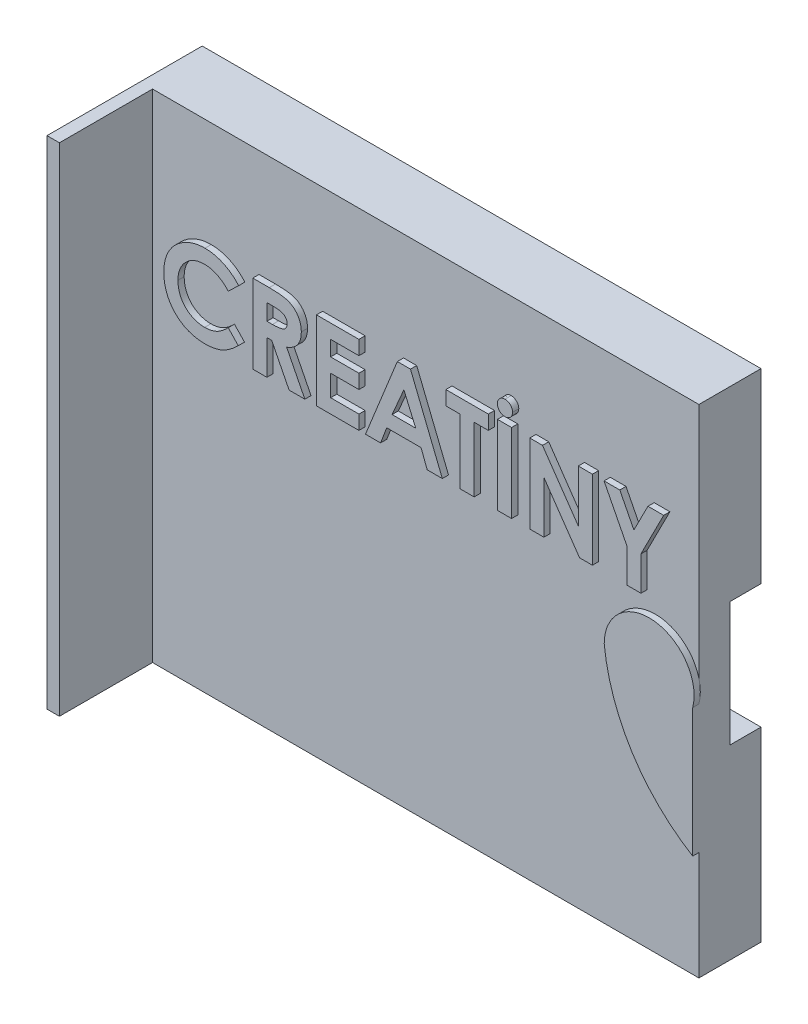
from build123d import *

# Parameters (mm, degrees)
IZIM1_W                     = 90
IZIM1_H                     = 80
Y_KSEKLIK_EKSTR_ZYON1_DEPTH = 5
IZIM2_W                     = 5
IZIM2_H                     = 20
KES_EKSTR_ZYON1_DEPTH       = 50
IZIM3_W                     = 15
IZIM3_H                     = 80
Y_KSEKLIK_EKSTR_ZYON2_DEPTH = 2
IZIM4_W                     = 2.279487179
IZIM4_H                     = 12.7
Y_KSEKLIK_EKSTR_ZYON3_DEPTH = 1


with BuildPart() as part:
    # Çizim1 → Yükseklik-Ekstrüzyon1 (new, symmetric)
    with BuildSketch(Plane.XY):
        Rectangle(IZIM1_W, IZIM1_H)
    extrude(amount=Y_KSEKLIK_EKSTR_ZYON1_DEPTH, both=True)

    # Çizim2 → Kes-Ekstrüzyon1 (cut)
    with BuildSketch(Plane(origin=(45, 0, 0), x_dir=(0, 0, -1), z_dir=(1, 0, 0))):
        with Locations((2.5, 0)):
            Rectangle(IZIM2_W, IZIM2_H)
    extrude(amount=-KES_EKSTR_ZYON1_DEPTH, mode=Mode.SUBTRACT)

    # Çizim3 → Yükseklik-Ekstrüzyon2 (add)
    with BuildSketch(Plane(origin=(-45, 0, 0), x_dir=(0, 0, -1), z_dir=(1, 0, 0))):
        with Locations((-12.5, 0)):
            Rectangle(IZIM3_W, IZIM3_H)
    extrude(amount=Y_KSEKLIK_EKSTR_ZYON2_DEPTH)

    # Çizim4 → Yükseklik-Ekstrüzyon3 (add)
    # profile 1 of 10: a face of its own
    with BuildSketch(Plane.XY.offset(5)):
        with BuildLine():
            Line((45, -1.789166458), (45, -22.5))
            ThreePointArc((45, -22.5), (35.238280105, -12.918835566), (30.744553942, 0))
            ThreePointArc((30.744553942, 0), (38.886155446, 7.183642163), (45, -1.789166458))
        make_face()
    # profile 2 of 10: a face of its own
    with BuildSketch(Plane.XY.offset(5)):
        with BuildLine():
            Line((-28.137179487, 20.496834936), (-29.808633814, 18.899158654))
            add(Edge.make_bspline(
                [(-29.808633814, 18.899158654), (-29.950420187, 19.045766001), (-30.227373394, 19.332136081), (-30.673649235, 19.71126483), (-31.13775986, 20.027217344), (-31.610676924, 20.29331054), (-32.100906834, 20.494629007), (-32.602781197, 20.641333165), (-33.119504629, 20.730773146), (-33.469203172, 20.741006662), (-33.645092147, 20.746153846)],
                knots=[0, 0, 0, 0, 1.115251505, 2.178435587, 3.19620269, 4.182487026, 5.141301733, 6.088180966, 7.038406374, 8, 8, 8, 8], degree=3))
            add(Edge.make_bspline(
                [(-33.645092147, 20.746153846), (-33.791980816, 20.742087391), (-34.081849421, 20.734062689), (-34.507452492, 20.675233713), (-34.914563825, 20.575192477), (-35.304577027, 20.437317123), (-35.676344466, 20.258913733), (-36.030645601, 20.040120387), (-36.366606915, 19.782913099), (-36.679790555, 19.488622671), (-36.966279943, 19.167088264), (-37.219411558, 18.824011819), (-37.431449891, 18.460179305), (-37.605466301, 18.079275349), (-37.741018358, 17.679536941), (-37.837819558, 17.261233199), (-37.893806784, 16.823865956), (-37.902163253, 16.526546964), (-37.906410256, 16.375440705)],
                knots=[0, 0, 0, 0, 1.035432265, 2.043311493, 3.022114605, 3.98653278, 4.95457646, 5.923598177, 6.917315552, 7.932509744, 8.948865224, 9.949768934, 10.933144597, 11.912367597, 12.897413939, 13.903909035, 14.934704909, 16, 16, 16, 16], degree=3))
            add(Edge.make_bspline(
                [(-37.906410256, 16.375440705), (-37.905186319, 16.26938376), (-37.902773912, 16.060343343), (-37.876365854, 15.751114549), (-37.833842653, 15.451089514), (-37.772301046, 15.160722695), (-37.695342662, 14.879762458), (-37.605052954, 14.605784974), (-37.491785843, 14.342575994), (-37.366057641, 14.087078518), (-37.219837191, 13.846264113), (-37.062184572, 13.616627591), (-36.891236046, 13.39929461), (-36.70588437, 13.195153631), (-36.503520948, 13.007394922), (-36.289376128, 12.830372355), (-36.059837582, 12.668517404), (-35.819673407, 12.517768141), (-35.566808889, 12.386810973), (-35.308104827, 12.26818908), (-35.039638748, 12.171850466), (-34.764679387, 12.094192754), (-34.484209352, 12.028156468), (-34.195485385, 11.987495897), (-33.901010361, 11.956704123), (-33.701994673, 11.954802911), (-33.601842949, 11.953846154)],
                knots=[0, 0, 0, 0, 1.103660481, 2.175337485, 3.227646561, 4.255952547, 5.262355991, 6.258840057, 7.255597736, 8.242457506, 9.22035537, 10.185017736, 11.140346927, 12.096287581, 13.051739095, 14.01125915, 14.986044842, 15.97314143, 16.960198552, 17.947847494, 18.933482797, 19.925264591, 20.920966487, 21.929612487, 22.958107872, 24, 24, 24, 24], degree=3))
            add(Edge.make_bspline(
                [(-33.601842949, 11.953846154), (-33.431968413, 11.958759827), (-33.098209124, 11.968413917), (-32.608369378, 12.043907532), (-32.141600899, 12.168090257), (-31.768655119, 12.314742839), (-31.476461951, 12.459564168), (-31.254019611, 12.593516765), (-31.023996895, 12.743357453), (-30.790214283, 12.91474138), (-30.550042184, 13.105611871), (-30.30772019, 13.320149346), (-30.057044815, 13.551289394), (-29.892829861, 13.716258587), (-29.808633814, 13.800841346)],
                knots=[0, 0, 0, 0, 1.404581149, 2.759636711, 4.088442092, 5.392261763, 6.066678138, 6.783632037, 7.538459478, 8.336747902, 9.180226004, 10.074962426, 11.012997595, 12, 12, 12, 12], degree=3))
            Line((-29.808633814, 13.800841346), (-28.188060897, 12.098858173))
            add(Edge.make_bspline(
                [(-28.188060897, 12.098858173), (-28.301978451, 11.988874352), (-28.524321152, 11.774209454), (-28.859718946, 11.469405329), (-29.194694627, 11.19550494), (-29.521155883, 10.942566902), (-29.844450489, 10.717959914), (-30.164544159, 10.521459659), (-30.477813294, 10.348096362), (-30.790763028, 10.200793709), (-31.105340696, 10.075718457), (-31.429004148, 9.968036875), (-31.762742853, 9.87694213), (-32.108595137, 9.803440635), (-32.463335099, 9.744502359), (-32.830282634, 9.704719363), (-33.207111114, 9.677974578), (-33.46271971, 9.675571338), (-33.591666667, 9.674358974)],
                knots=[0, 0, 0, 0, 1.244526981, 2.429050516, 3.560637417, 4.644440555, 5.67424972, 6.652764056, 7.595344123, 8.486817594, 9.369275933, 10.254498637, 11.166417451, 12.086725134, 13.032340136, 13.991389299, 14.986715468, 16, 16, 16, 16], degree=3))
            add(Edge.make_bspline(
                [(-33.591666667, 9.674358974), (-33.828526253, 9.680396998), (-34.291994624, 9.692211731), (-34.971195438, 9.779750903), (-35.616417979, 9.926508784), (-36.229231953, 10.134064907), (-36.8094425, 10.399208127), (-37.356901183, 10.724261264), (-37.870725621, 11.108360704), (-38.346765124, 11.547004428), (-38.777365511, 12.031449597), (-39.157966386, 12.551610806), (-39.472799445, 13.110044456), (-39.734212117, 13.698500699), (-39.938633389, 14.319664889), (-40.082511309, 14.974208936), (-40.171239773, 15.661500838), (-40.180946793, 16.13093705), (-40.185897436, 16.370352564)],
                knots=[0, 0, 0, 0, 1.078019885, 2.10938526, 3.111377082, 4.085535484, 5.04941344, 6.010039228, 6.978205633, 7.964457913, 8.951525778, 9.924444315, 10.892603023, 11.863865945, 12.85144698, 13.863884204, 14.910567087, 16, 16, 16, 16], degree=3))
            add(Edge.make_bspline(
                [(-40.185897436, 16.370352564), (-40.183805534, 16.526497319), (-40.179659896, 16.835938061), (-40.136088854, 17.291769345), (-40.075348289, 17.73612331), (-39.978988905, 18.164386091), (-39.862837171, 18.582327176), (-39.71838723, 18.985404036), (-39.545869787, 19.374775152), (-39.350845487, 19.751092356), (-39.130216447, 20.111890367), (-38.883749589, 20.454069362), (-38.61778993, 20.780270898), (-38.325946895, 21.086167307), (-38.012461343, 21.37444442), (-37.675917924, 21.643540007), (-37.318340779, 21.897313202), (-36.938762078, 22.129219811), (-36.544556026, 22.338991665), (-36.140694597, 22.5240194), (-35.728170032, 22.678659977), (-35.308726522, 22.806928632), (-34.880591925, 22.902672113), (-34.446822155, 22.975146839), (-34.003726353, 23.015660675), (-33.706225908, 23.022293048), (-33.556049679, 23.025641026)],
                knots=[0, 0, 0, 0, 1.071919942, 2.124283339, 3.142214191, 4.149696895, 5.136002878, 6.119640489, 7.086990633, 8.058538607, 9.028339693, 9.988281803, 10.952401235, 11.916291999, 12.888973767, 13.874849856, 14.873389453, 15.898127285, 16.927174885, 17.938320013, 18.946391617, 19.950418109, 20.947802303, 21.956882652, 22.968648068, 24, 24, 24, 24], degree=3))
            add(Edge.make_bspline(
                [(-33.556049679, 23.025641026), (-33.427933958, 23.023721881), (-33.173034563, 23.019903546), (-32.793446589, 22.988073571), (-32.416894382, 22.938084917), (-32.044726114, 22.862662682), (-31.674279657, 22.773126959), (-31.310423094, 22.655892281), (-30.94741639, 22.525212138), (-30.590952765, 22.369010711), (-30.24053465, 22.198502744), (-29.90437114, 22.005055263), (-29.576818081, 21.80057281), (-29.265133853, 21.572953218), (-28.963479937, 21.330452672), (-28.67343371, 21.071939772), (-28.397540497, 20.793104348), (-28.224405235, 20.596090662), (-28.137179487, 20.496834936)],
                knots=[0, 0, 0, 0, 0.996412454, 1.982464992, 2.961075852, 3.949442424, 4.934965278, 5.923860011, 6.921385422, 7.934793307, 8.949617135, 9.951082467, 10.950285876, 11.951772932, 12.951063433, 13.960125323, 14.972308753, 16, 16, 16, 16], degree=3))
        make_face()
    # profile 3 of 10: a face of its own
    with BuildSketch(Plane.XY.offset(5)):
        with BuildLine():
            Line((-25.857692308, 22.7), (-23.201682692, 22.7))
            add(Edge.make_bspline(
                [(-23.201682692, 22.7), (-23.026121265, 22.699376858), (-22.688467188, 22.69817838), (-22.201588451, 22.679269568), (-21.754323374, 22.652956405), (-21.346009741, 22.612801821), (-20.976822235, 22.559561695), (-20.646390845, 22.496800397), (-20.354725227, 22.425270442), (-20.099365586, 22.336138475), (-19.868916138, 22.235598967), (-19.654105213, 22.120077229), (-19.450193764, 21.990859631), (-19.258544718, 21.84454611), (-19.0774926, 21.68376881), (-18.906695844, 21.508365891), (-18.748567967, 21.31685001), (-18.604088104, 21.110431304), (-18.472406338, 20.893283559), (-18.356027275, 20.665108629), (-18.261387628, 20.425747835), (-18.177763354, 20.178660456), (-18.117531499, 19.920314331), (-18.075641125, 19.653224502), (-18.044970632, 19.376450785), (-18.043207225, 19.188423011), (-18.042307692, 19.092508013)],
                knots=[0, 0, 0, 0, 1.749336639, 3.364467119, 4.854658419, 6.213483162, 7.451590619, 8.570285859, 9.5643256, 10.440900261, 11.26203566, 12.067320669, 12.869050712, 13.665104639, 14.467235401, 15.27997916, 16.102287765, 16.939272006, 17.78853747, 18.631303466, 19.488103222, 20.351255419, 21.228522269, 22.127379805, 23.044756219, 24, 24, 24, 24], degree=3))
            add(Edge.make_bspline(
                [(-18.042307692, 19.092508013), (-18.044644355, 18.992394789), (-18.049226125, 18.796091003), (-18.07390603, 18.507736752), (-18.119013143, 18.231859574), (-18.187334428, 17.969267204), (-18.26586087, 17.716691374), (-18.370280896, 17.478792264), (-18.488129216, 17.252109978), (-18.628094222, 17.039851023), (-18.781698979, 16.837300702), (-18.960338079, 16.652219471), (-19.152438454, 16.474659913), (-19.368798765, 16.315743758), (-19.599881649, 16.164725668), (-19.850278479, 16.027863061), (-20.11835508, 15.901715526), (-20.306826206, 15.831366946), (-20.403205128, 15.795392628)],
                knots=[0, 0, 0, 0, 1.099860209, 2.156625411, 3.176576793, 4.16617041, 5.135385252, 6.078461593, 7.016046972, 7.938469504, 8.868247731, 9.803980173, 10.76021508, 11.73834243, 12.748633912, 13.790971185, 14.870363756, 16, 16, 16, 16], degree=3))
            Line((-20.403205128, 15.795392628), (-17.472435897, 10))
            Line((-17.472435897, 10), (-20.006330128, 10))
            Line((-20.006330128, 10), (-22.804807692, 15.535897436))
            Line((-22.804807692, 15.535897436), (-23.578205128, 15.535897436))
            Line((-23.578205128, 15.535897436), (-23.578205128, 10))
            Line((-23.578205128, 10), (-25.857692308, 10))
            Line((-25.857692308, 10), (-25.857692308, 22.7))
        make_face()
        with BuildLine():
            Line((-23.578205128, 17.815384615), (-22.690324519, 17.815384615))
            add(Edge.make_bspline(
                [(-22.690324519, 17.815384615), (-22.581773734, 17.816607187), (-22.373922306, 17.81894815), (-22.075004652, 17.829806504), (-21.803516134, 17.855969773), (-21.55829089, 17.889026085), (-21.338094966, 17.92719437), (-21.144892435, 17.981891842), (-20.975706338, 18.040501566), (-20.832541539, 18.113338251), (-20.710224824, 18.196169359), (-20.60461217, 18.290267557), (-20.517255361, 18.399174239), (-20.445356252, 18.519929791), (-20.389426563, 18.653602268), (-20.348602174, 18.798724247), (-20.325787377, 18.956948855), (-20.323162457, 19.066145378), (-20.321794872, 19.123036859)],
                knots=[0, 0, 0, 0, 1.688639943, 3.233382647, 4.650958383, 5.928841754, 7.082724185, 8.122798841, 9.049171256, 9.863274652, 10.613301712, 11.341792392, 12.054588806, 12.776240173, 13.521029143, 14.301969904, 15.115324896, 16, 16, 16, 16], degree=3))
            add(Edge.make_bspline(
                [(-20.321794872, 19.123036859), (-20.324380418, 19.190343634), (-20.329459243, 19.32255532), (-20.37985697, 19.512893789), (-20.460079266, 19.689065065), (-20.570042061, 19.850273162), (-20.708525905, 19.991599308), (-20.867447042, 20.116179432), (-21.050235374, 20.214688072), (-21.219483615, 20.279663322), (-21.373459953, 20.318538684), (-21.512418741, 20.34750826), (-21.673333853, 20.368039831), (-21.856326773, 20.389817216), (-22.060931045, 20.403938747), (-22.288261885, 20.414244651), (-22.537666399, 20.418461302), (-22.711525033, 20.419809291), (-22.802263622, 20.420512821)],
                knots=[0, 0, 0, 0, 1.020303359, 2.004196876, 2.966617323, 3.9489082, 4.950758222, 5.960522915, 7.003732012, 8.091992268, 8.70421221, 9.413913587, 10.24622431, 11.166358409, 12.212345909, 13.359657661, 14.621978493, 16, 16, 16, 16], degree=3))
            Line((-22.802263622, 20.420512821), (-23.578205128, 20.420512821))
            Line((-23.578205128, 20.420512821), (-23.578205128, 17.815384615))
        make_face(mode=Mode.SUBTRACT)
    # profile 4 of 10: a face of its own
    with BuildSketch(Plane.XY.offset(5)):
        Polygon((-15.6, 22.7), (-8.761538462, 22.7), (-8.761538462, 20.420512821), (-13.320512821, 20.420512821), (-13.320512821, 17.978205128), (-8.761538462, 17.978205128), (-8.761538462, 15.698717949), (-13.320512821, 15.698717949), (-13.320512821, 12.279487179), (-8.761538462, 12.279487179), (-8.761538462, 10), (-15.6, 10), align=None)
    # profile 5 of 10: a face of its own
    with BuildSketch(Plane.XY.offset(5)):
        Polygon((-2.571814904, 22.7), (-0.457692308, 22.7), (4.671153846, 10), (2.236478365, 10), (1.249379006, 12.605128205), (-4.283974359, 12.605128205), (-5.271073718, 10), (-7.703205128, 10), align=None)
        Polygon((-1.516025641, 19.293489583), (-3.418990385, 14.884615385), (0.386939103, 14.884615385), align=None, mode=Mode.SUBTRACT)
    # profile 6 of 10: a face of its own
    with BuildSketch(Plane.XY.offset(5)):
        Polygon((5.241025641, 22.7), (12.079487179, 22.7), (12.079487179, 20.420512821), (9.8, 20.420512821), (9.8, 10), (7.520512821, 10), (7.520512821, 20.420512821), (5.241025641, 20.420512821), align=None)
    # profile 7 of 10: a face of its own
    with BuildSketch(Plane.XY.offset(5)):
        with Locations((14.684615385, 16.35)):
            Rectangle(IZIM4_W, IZIM4_H)
    # profile 8 of 10: a face of its own
    with BuildSketch(Plane.XY.offset(5)):
        with BuildLine():
            add(Edge.make_bspline(
                [(14.7609375, 26.119230769), (14.843654107, 26.114880169), (15.005099411, 26.10638872), (15.237036846, 26.038094928), (15.4479974, 25.922946037), (15.633157807, 25.76517222), (15.790104297, 25.580456585), (15.906107539, 25.371804854), (15.974067151, 25.143085752), (15.98275203, 24.984175696), (15.987179487, 24.903165064)],
                knots=[0, 0, 0, 0, 1.033757622, 2.017676021, 2.99585523, 4.020311853, 5.044768476, 6.013636162, 6.987373143, 8, 8, 8, 8], degree=3))
            add(Edge.make_bspline(
                [(15.987179487, 24.903165064), (15.982864816, 24.820430855), (15.97444349, 24.658951194), (15.905429712, 24.426539295), (15.791633707, 24.214066542), (15.633807903, 24.028376665), (15.447148539, 23.873419286), (15.237134274, 23.757934293), (15.005073547, 23.68979821), (14.843645344, 23.681284885), (14.7609375, 23.676923077)],
                knots=[0, 0, 0, 0, 1.028208009, 2.006844351, 2.989059939, 4.008016881, 5.020227687, 5.993155649, 6.971791991, 8, 8, 8, 8], degree=3))
            add(Edge.make_bspline(
                [(14.7609375, 23.676923077), (14.679918664, 23.681326402), (14.520992516, 23.689963942), (14.291670069, 23.758482795), (14.082491084, 23.873490121), (13.895547843, 24.027563011), (13.74066268, 24.214965198), (13.62648997, 24.426429973), (13.55764259, 24.658980101), (13.549198255, 24.820440648), (13.544871795, 24.903165064)],
                knots=[0, 0, 0, 0, 1.011983718, 1.98510226, 2.962660208, 3.97968794, 4.996715672, 5.983605444, 6.966898937, 8, 8, 8, 8], degree=3))
            add(Edge.make_bspline(
                [(13.544871795, 24.903165064), (13.54931072, 24.984166183), (13.558018095, 25.143057577), (13.625814221, 25.371912302), (13.742175713, 25.579569893), (13.896189608, 25.765994173), (14.081642328, 25.922875616), (14.291766444, 26.037547769), (14.520967344, 26.106222104), (14.679910165, 26.114838317), (14.7609375, 26.119230769)],
                knots=[0, 0, 0, 0, 1.017471896, 1.995867844, 2.969371198, 3.991914463, 5.021272727, 6.004132156, 6.982528104, 8, 8, 8, 8], degree=3))
        make_face()
    # profile 9 of 10: a face of its own
    with BuildSketch(Plane.XY.offset(5)):
        Polygon((18.755128205, 22.7), (20.808193109, 22.7), (26.570512821, 14.342728365), (26.570512821, 22.7), (28.85, 22.7), (28.85, 10), (26.781670673, 10), (21.034615385, 18.331830929), (21.034615385, 10), (18.755128205, 10), align=None)
    # profile 10 of 10: a face of its own
    with BuildSketch(Plane.XY.offset(5)):
        Polygon((30.722435897, 22.7), (33.258874199, 22.7), (35.525641026, 18.245332532), (37.792407853, 22.7), (40.328846154, 22.7), (36.665384615, 15.500280449), (36.665384615, 10), (34.385897436, 10), (34.385897436, 15.500280449), align=None)
    extrude(amount=Y_KSEKLIK_EKSTR_ZYON3_DEPTH)


solid = part.part
